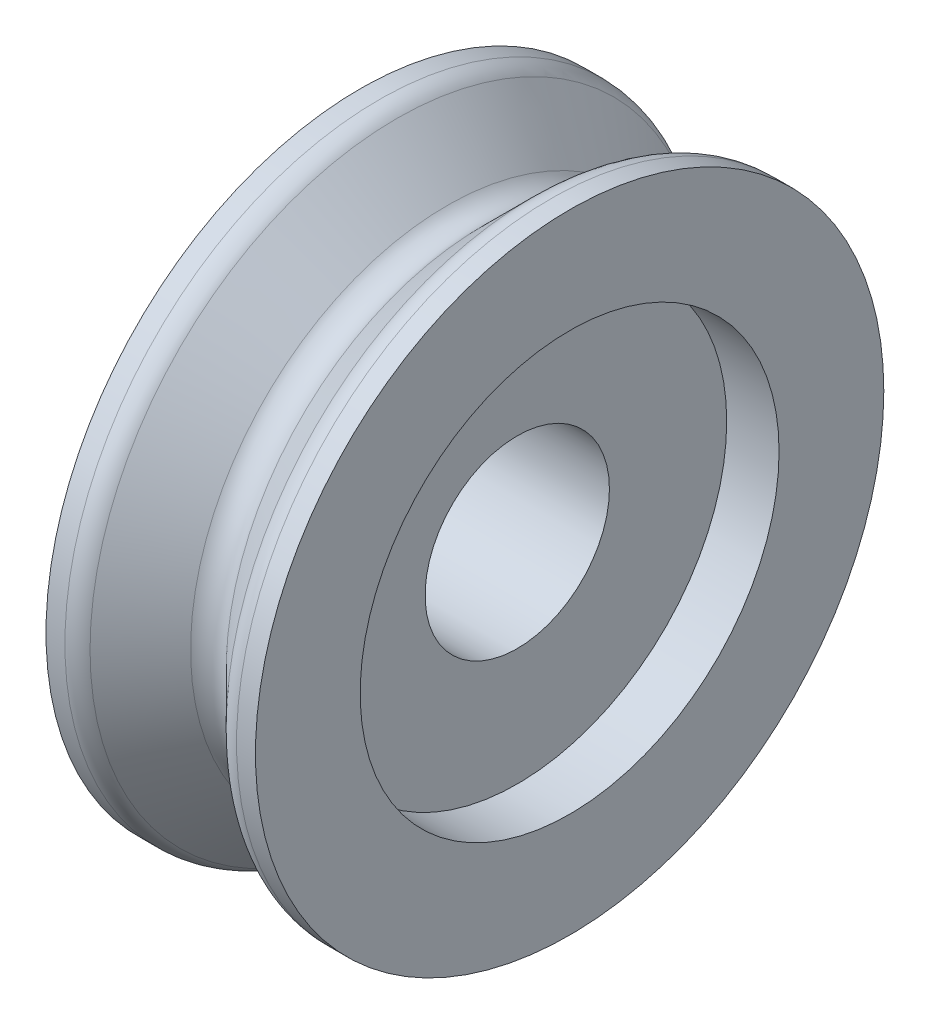
from build123d import *


with BuildPart() as part:
    # Sketch1 → Revolve1 (revolve)
    with BuildSketch(Plane.XY, mode=Mode.PRIVATE) as revolve1_sk:
        with BuildLine():
            Line((-3.175, 6.35), (-4.7625, 6.35))
            Line((-4.7625, 6.35), (-4.7625, 2.794))
            Line((-4.7625, 2.794), (-9.525, 2.794))
            Line((-9.525, 2.794), (-9.525, 9.525))
            Line((-9.525, 9.525), (-8.951630735, 9.525))
            ThreePointArc((-8.951630735, 9.525), (-8.660025959, 9.466996204), (-8.412815367, 9.301815367))
            Line((-8.412815367, 9.301815367), (-6.888815367, 7.777815367))
            ThreePointArc((-6.888815367, 7.777815367), (-6.35, 7.554630735), (-5.811184633, 7.777815367))
            Line((-5.811184633, 7.777815367), (-4.287184633, 9.301815367))
            ThreePointArc((-4.287184633, 9.301815367), (-4.039974041, 9.466996204), (-3.748369265, 9.525))
            Line((-3.748369265, 9.525), (-3.175, 9.525))
            Line((-3.175, 9.525), (-3.175, 6.35))
        make_face()
    revolve(revolve1_sk.sketch.rotate(Axis((0, 0, 0), (-1, 0, 0)), 90), axis=Axis((0, 0, 0), (-1, 0, 0)))


solid = part.part
